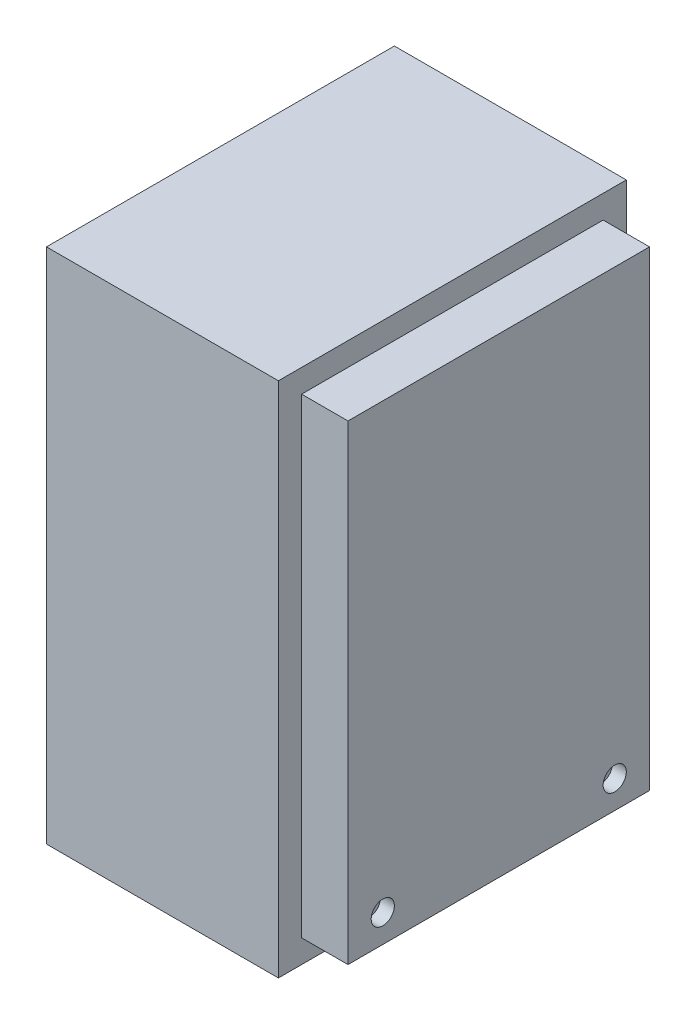
from build123d import *

# Parameters (mm, degrees)
CROQUIS1_W              = 150
CROQUIS1_H              = 223
SALIENTE_EXTRUIR1_DEPTH = 100
CROQUIS2_W              = 130
CROQUIS2_H              = 203
SALIENTE_EXTRUIR2_DEPTH = 20
CROQUIS3_R              = 5
CORTAR_EXTRUIR1_DEPTH   = 6


with BuildPart() as part:
    # Croquis1 → Saliente-Extruir1 (new body)
    with BuildSketch(Plane(origin=(0, 0, 0), x_dir=(0, 0, -1), z_dir=(1, 0, 0))):
        Rectangle(CROQUIS1_W, CROQUIS1_H)
    extrude(amount=SALIENTE_EXTRUIR1_DEPTH)

    # Croquis2 → Saliente-Extruir2 (add)
    with BuildSketch(Plane(origin=(100, 0, 0), x_dir=(0, 0, -1), z_dir=(1, 0, 0))):
        Rectangle(CROQUIS2_W, CROQUIS2_H)
    extrude(amount=SALIENTE_EXTRUIR2_DEPTH)

    # Croquis3 → Cortar-Extruir1 (cut)
    with BuildSketch(Plane(origin=(120, 0, 0), x_dir=(0, 0, -1), z_dir=(1, 0, 0))):
        with Locations((-50, -89.5)):
            Circle(CROQUIS3_R)
        with Locations((50, -89.5)):
            Circle(CROQUIS3_R)
    extrude(amount=-CORTAR_EXTRUIR1_DEPTH, mode=Mode.SUBTRACT)


solid = part.part
